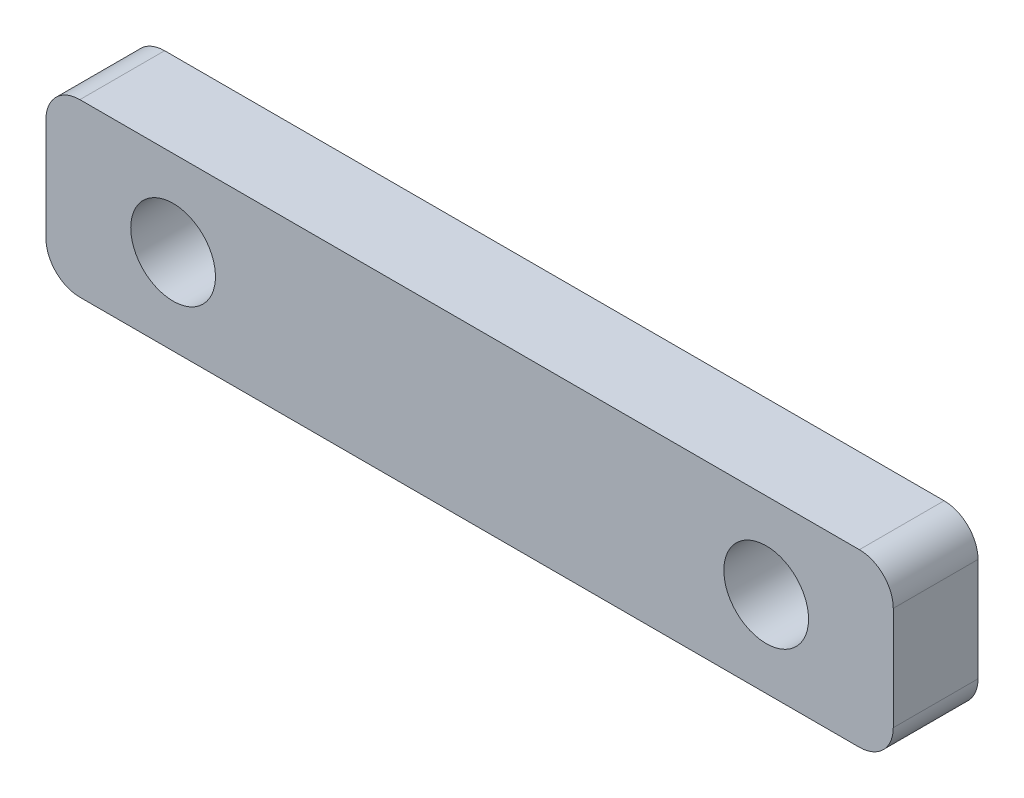
from build123d import *

# Parameters (mm, degrees)
ESQUISSE1_R        = 2.5
BOSS_EXTRU_1_DEPTH = 5


with BuildPart() as part:
    # Esquisse1 → Boss.-Extru.1 (new body)
    with BuildSketch(Plane.XY):
        with BuildLine():
            Line((-11.455666155, 13.994472362), (34.544333845, 13.994472362))
            ThreePointArc((34.544333845, 13.994472362), (35.958547407, 13.408685924), (36.544333845, 11.994472362))
            Line((36.544333845, 11.994472362), (36.544333845, 5.894472362))
            ThreePointArc((36.544333845, 5.894472362), (35.958547407, 4.480258799), (34.544333845, 3.894472362))
            Line((34.544333845, 3.894472362), (-11.455666155, 3.894472362))
            ThreePointArc((-11.455666155, 3.894472362), (-12.869879717, 4.480258799), (-13.455666155, 5.894472362))
            Line((-13.455666155, 5.894472362), (-13.455666155, 11.994472362))
            ThreePointArc((-13.455666155, 11.994472362), (-12.869879717, 13.408685924), (-11.455666155, 13.994472362))
        make_face()
        with Locations((29.044333845, 8.944472362)):
            Circle(ESQUISSE1_R, mode=Mode.SUBTRACT)
        with Locations(Location((-5.955666155, 8.944472362, 0), (0, 0, 180))):
            Circle(ESQUISSE1_R, mode=Mode.SUBTRACT)
    extrude(amount=BOSS_EXTRU_1_DEPTH)


solid = part.part
